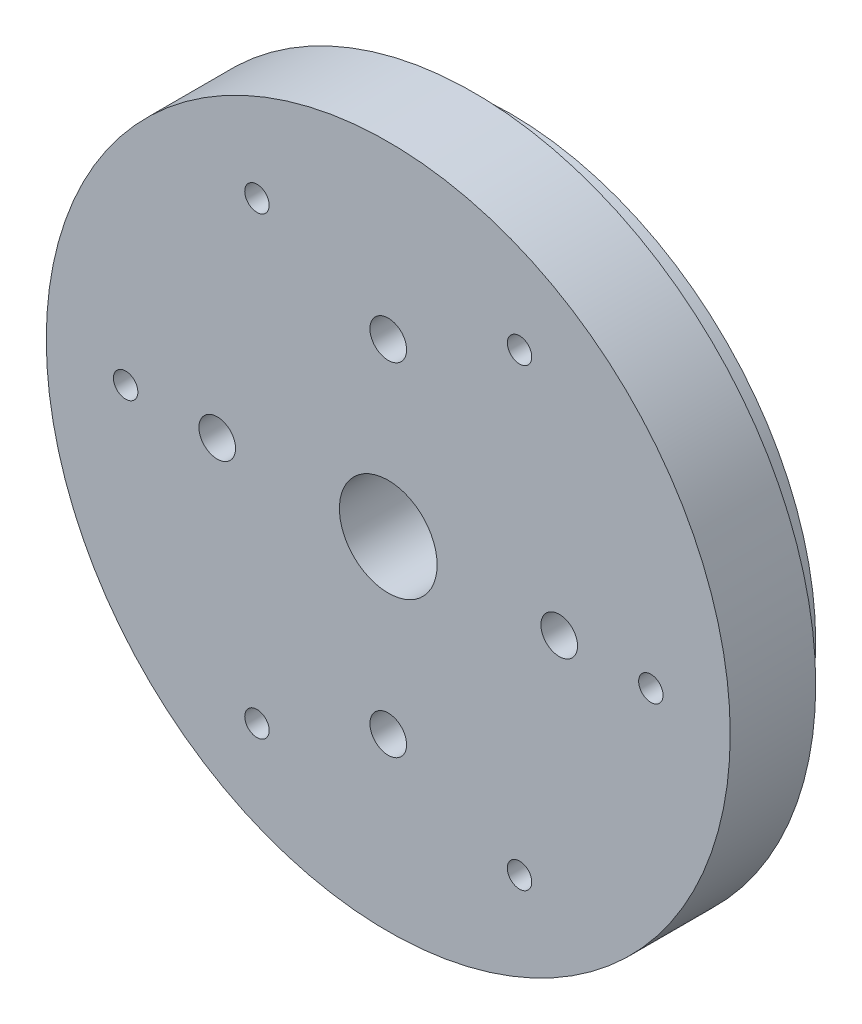
from build123d import *

# Parameters (mm, degrees)
SKETCH1_R           = 28
SKETCH1_R_2         = 4
SKETCH1_R_3         = 1.5
BOSS_EXTRUDE1_DEPTH = 7
SKETCH2_R           = 25
SKETCH2_R_2         = 18
BOSS_EXTRUDE2_DEPTH = 3
SKETCH3_R           = 1
CUT_EXTRUDE1_DEPTH  = 10


with BuildPart() as part:
    # Sketch1 → Boss-Extrude1 (new body)
    with BuildSketch(Plane.XY):
        Circle(SKETCH1_R)
        Circle(SKETCH1_R_2, mode=Mode.SUBTRACT)
        with Locations((0, 14)):
            Circle(SKETCH1_R_3, mode=Mode.SUBTRACT)
        with Locations((14, 0)):
            Circle(SKETCH1_R_3, mode=Mode.SUBTRACT)
        with Locations((0, -14)):
            Circle(SKETCH1_R_3, mode=Mode.SUBTRACT)
        with Locations((-14, 0)):
            Circle(SKETCH1_R_3, mode=Mode.SUBTRACT)
    extrude(amount=BOSS_EXTRUDE1_DEPTH)

    # Sketch2 → Boss-Extrude2 (add)
    with BuildSketch(Plane(origin=(0, 0, 0), x_dir=(-1, 0, 0), z_dir=(0, 0, -1))):
        with Locations(Location((0, 0, 0), (0, 0, 180))):
            Circle(SKETCH2_R)
        Circle(SKETCH2_R_2, mode=Mode.SUBTRACT)
    extrude(amount=BOSS_EXTRUDE2_DEPTH)

    # Sketch3 → Cut-Extrude1 (cut)
    with BuildSketch(Plane(origin=(0, 0, -3), x_dir=(-1, 0, 0), z_dir=(0, 0, -1))):
        with Locations((-10.75, 18.619546181)):
            Circle(SKETCH3_R)
        with Locations((10.75, 18.619546181)):
            Circle(SKETCH3_R)
        with Locations((21.5, 0)):
            Circle(SKETCH3_R)
        with Locations((10.75, -18.619546181)):
            Circle(SKETCH3_R)
        with Locations((-10.75, -18.619546181)):
            Circle(SKETCH3_R)
        with Locations((-21.5, 0)):
            Circle(SKETCH3_R)
    extrude(amount=-CUT_EXTRUDE1_DEPTH, mode=Mode.SUBTRACT)


solid = part.part
